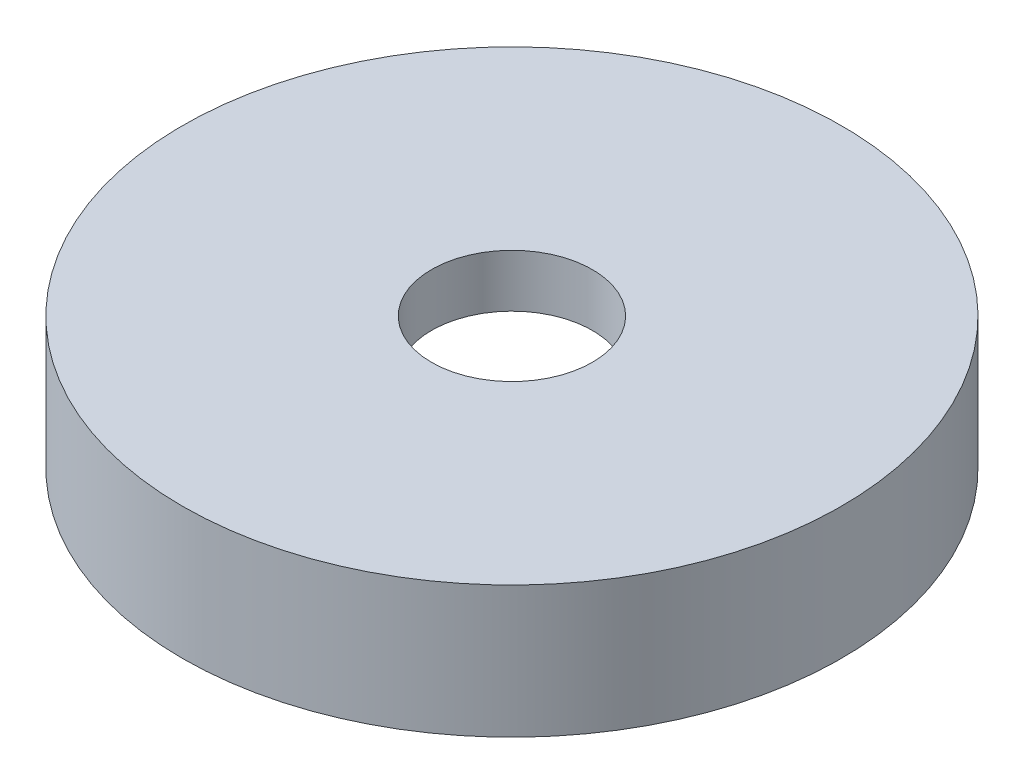
from build123d import *

# Parameters (mm, degrees)
SKETCH1_R           = 12.5
BOSS_EXTRUDE1_DEPTH = 3
SKETCH2_R           = 12.5
SKETCH2_R_2         = 3.05
BOSS_EXTRUDE2_DEPTH = 2


with BuildPart() as part:
    # Sketch1 → Boss-Extrude1 (new body)
    with BuildSketch(Plane(origin=(0, 0, 0), x_dir=(1, 0, 0), z_dir=(0, 1, 0))):
        with Locations(Location((0, 0, 0), (0, 0, 270))):
            Circle(SKETCH1_R)
        Polygon((9.93042463, 0), (4.965212315, 8.6), (-4.965212315, 8.6), (-9.93042463, 0), (-4.965212315, -8.6), (4.965212315, -8.6), align=None, mode=Mode.SUBTRACT)
    extrude(amount=BOSS_EXTRUDE1_DEPTH)

    # Sketch2 → Boss-Extrude2 (add)
    with BuildSketch(Plane(origin=(0, 3, 0), x_dir=(1, 0, 0), z_dir=(0, 1, 0))):
        with Locations(Location((0, 0, 0), (0, 0, 270))):
            Circle(SKETCH2_R)
        with Locations(Location((0, 0, 0), (0, 0, 270))):
            Circle(SKETCH2_R_2, mode=Mode.SUBTRACT)
    extrude(amount=BOSS_EXTRUDE2_DEPTH)


solid = part.part
